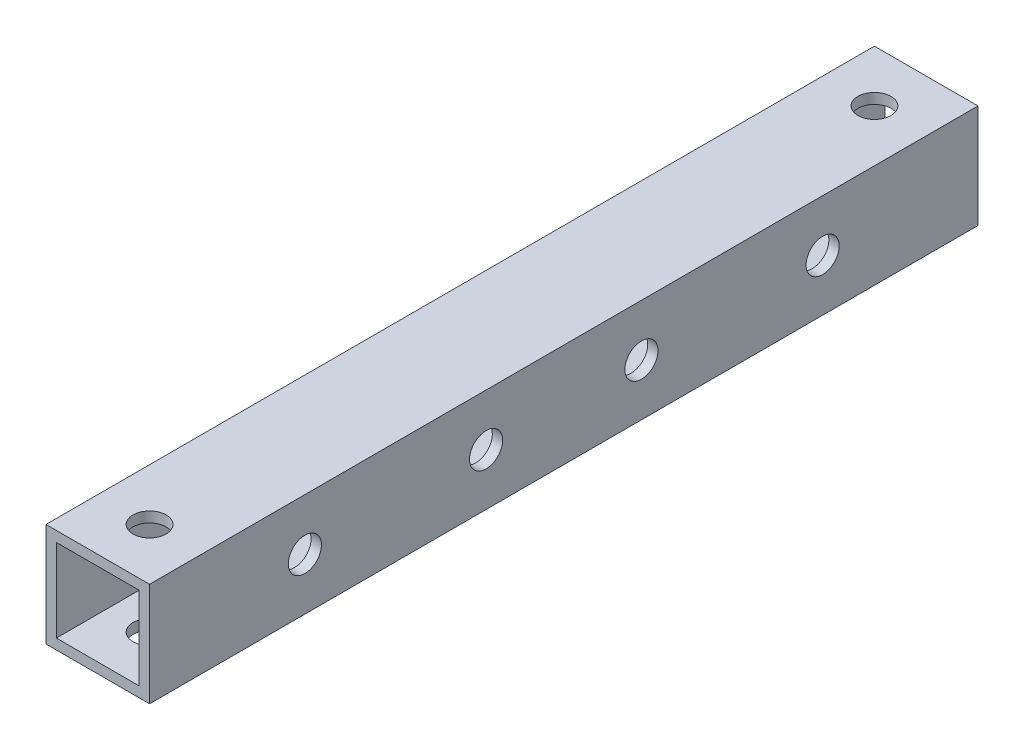
from build123d import *

# Parameters (mm, degrees)
SKETCH_1_W          = 10
SKETCH_1_H          = 10
SKETCH_1_W_2        = 8
SKETCH_1_H_2        = 8
EXTRUDE_1_DEPTH     = 80
SKETCH_2_R          = 1.6
CUT_EXTRUDE_1_DEPTH = 81.777472107
SKETCH_3_R          = 1.6
CUT_EXTRUDE_2_DEPTH = 81.777472107


with BuildPart() as part:
    # ｽｹｯﾁ1 → ﾎﾞｽ - 押し出し1 (new body)
    with BuildSketch(Plane.XY):
        Rectangle(SKETCH_1_W, SKETCH_1_H)
        Rectangle(SKETCH_1_W_2, SKETCH_1_H_2, mode=Mode.SUBTRACT)
    extrude(amount=EXTRUDE_1_DEPTH)

    # ｽｹｯﾁ2 → ｶｯﾄ - 押し出し1 (cut, through all)
    with BuildSketch(Plane.ZY.offset(5)):
        with Locations(Location((15, 0, 0), (0, 0, 270))):
            Circle(SKETCH_2_R)
        with Locations(Location((65, 0, 0), (0, 0, 270))):
            Circle(SKETCH_2_R)
        with Locations(Location((32.5, 0, 0), (0, 0, 270))):
            Circle(SKETCH_2_R)
        with Locations(Location((47.5, 0, 0), (0, 0, 270))):
            Circle(SKETCH_2_R)
    extrude(amount=-CUT_EXTRUDE_1_DEPTH, mode=Mode.SUBTRACT)

    # ｽｹｯﾁ3 → ｶｯﾄ - 押し出し2 (cut, through all)
    with BuildSketch(Plane(origin=(0, 5, 0), x_dir=(1, 0, 0), z_dir=(0, 1, 0))):
        with Locations(Location((0, -5, 0), (0, 0, 270))):
            Circle(SKETCH_3_R)
        with Locations(Location((0, -75, 0), (0, 0, 270))):
            Circle(SKETCH_3_R)
    extrude(amount=-CUT_EXTRUDE_2_DEPTH, mode=Mode.SUBTRACT)


solid = part.part
